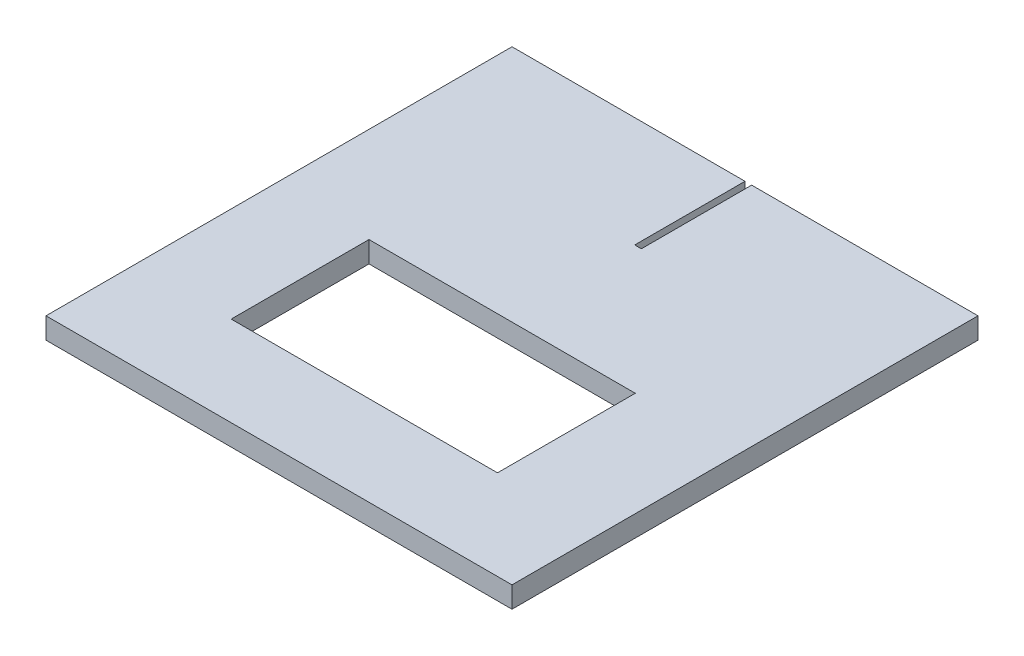
from build123d import *

# Parameters (mm, degrees)
SKETCH1_W           = 70
SKETCH1_H           = 70
BOSS_EXTRUDE1_DEPTH = 3.175
SKETCH2_W           = 1
SKETCH2_H           = 16.56370183
CUT_EXTRUDE1_DEPTH  = 3.175
SKETCH3_W           = 40
SKETCH3_H           = 20.7
CUT_EXTRUDE2_DEPTH  = 3.175


with BuildPart() as part:
    # Sketch1 → Boss-Extrude1 (new body)
    with BuildSketch(Plane(origin=(0, 0, 0), x_dir=(1, 0, 0), z_dir=(0, 1, 0))):
        Rectangle(SKETCH1_W, SKETCH1_H)
    extrude(amount=BOSS_EXTRUDE1_DEPTH)

    # Sketch2 → Cut-Extrude1 (cut)
    with BuildSketch(Plane(origin=(0, 3.175, 0), x_dir=(1, 0, 0), z_dir=(0, 1, 0))):
        with Locations((0.5, 26.718149085)):
            Rectangle(SKETCH2_W, SKETCH2_H)
    extrude(amount=-CUT_EXTRUDE1_DEPTH, mode=Mode.SUBTRACT)

    # Sketch3 → Cut-Extrude2 (cut)
    with BuildSketch(Plane(origin=(0, 0, 0), x_dir=(-1, 0, 0), z_dir=(0, -1, 0))):
        with Locations((0.662640496, -11.168119056)):
            Rectangle(SKETCH3_W, SKETCH3_H)
    extrude(amount=-CUT_EXTRUDE2_DEPTH, mode=Mode.SUBTRACT)


solid = part.part
